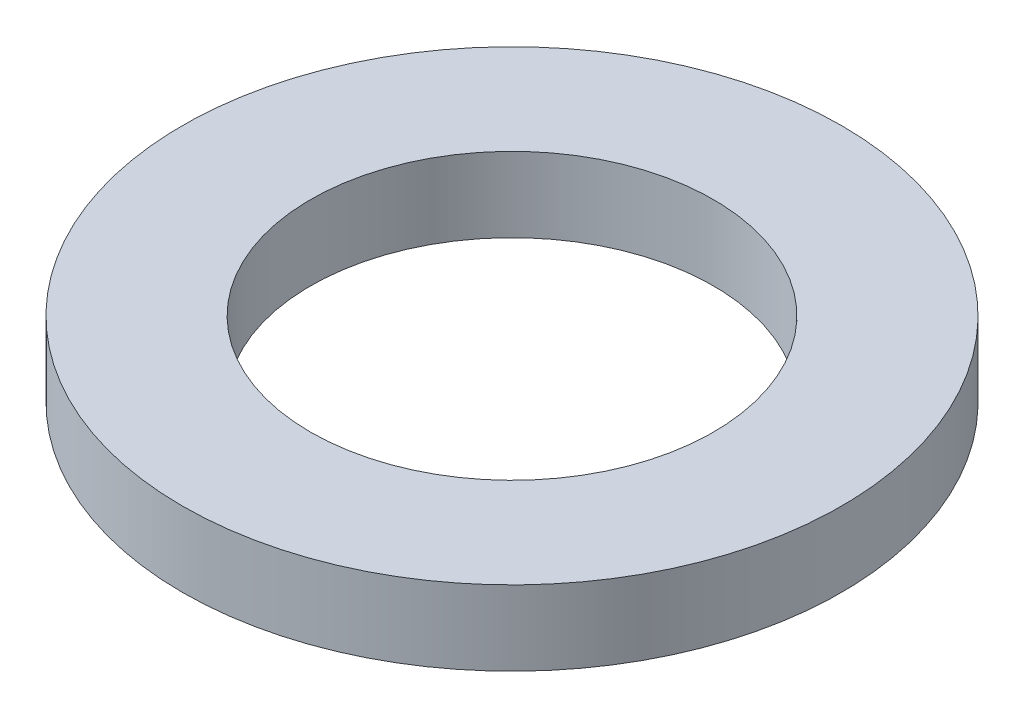
from build123d import *

# Parameters (mm, degrees)
SKETCH1_R           = 15.6845
SKETCH1_R_2         = 9.5885
BOSS_EXTRUDE1_DEPTH = 3.559175


with BuildPart() as part:
    # Sketch1 → Boss-Extrude1 (new body)
    with BuildSketch(Plane(origin=(0, 0, 0), x_dir=(1, 0, 0), z_dir=(0, 1, 0))):
        with Locations(Location((0, 0, 0), (0, 0, 270))):
            Circle(SKETCH1_R)
        with Locations(Location((0, 0, 0), (0, 0, 270))):
            Circle(SKETCH1_R_2, mode=Mode.SUBTRACT)
    extrude(amount=BOSS_EXTRUDE1_DEPTH)


solid = part.part
